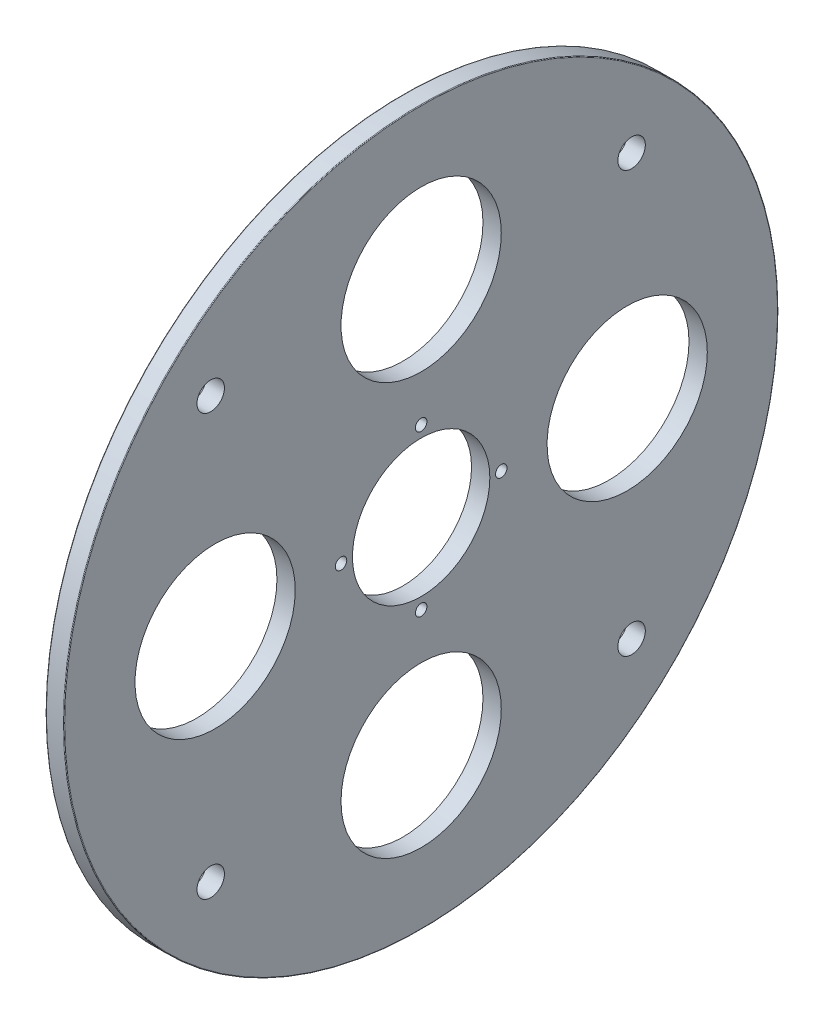
from build123d import *

# Parameters (mm, degrees)
SKETCH_1_R               = 156
EXTRUDE_1_DEPTH          = 8
SKETCH_2_R               = 30
CUT_EXTRUDE_1_DEPTH      = 10
SKETCH_3_R               = 35
CUT_EXTRUDE_2_DEPTH      = 10
PATTERN_CIRCULAR_1_COUNT = 4
SKETCH_4_R               = 6
CUT_EXTRUDE_3_DEPTH      = 10
PATTERN_CIRCULAR_2_COUNT = 4
SKETCH_6_R               = 2.5
CUT_EXTRUDE_5_DEPTH      = 10
PATTERN_CIRCULAR_4_COUNT = 4
FILLET_1_R               = 0.3


with BuildPart() as part:
    # 草图1 → 凸台-拉伸1 (new body)
    with BuildSketch(Plane(origin=(0, 0, 0), x_dir=(0, 0, -1), z_dir=(1, 0, 0))):
        Circle(SKETCH_1_R)
    extrude(amount=EXTRUDE_1_DEPTH)

    # 草图2 → 切除-拉伸1 (cut)
    with BuildSketch(Plane(origin=(8, 0, 0), x_dir=(0, 0, -1), z_dir=(1, 0, 0))):
        Circle(SKETCH_2_R)
    extrude(amount=-CUT_EXTRUDE_1_DEPTH, mode=Mode.SUBTRACT)

    # 草图3 → 切除-拉伸2 (cut)
    with BuildSketch(Plane(origin=(8, 0, 0), x_dir=(0, 0, -1), z_dir=(1, 0, 0))):
        with Locations((0, 90)):
            Circle(SKETCH_3_R)
    cut_extrude_2 = extrude(amount=-CUT_EXTRUDE_2_DEPTH, mode=Mode.SUBTRACT)

    # 阵列(圆周)1: 切除-拉伸2 ×4 about axis
    pattern_circular_1_axis = Axis((0, 0, 0), (1, 0, 0))
    for i in range(1, PATTERN_CIRCULAR_1_COUNT):
        add(cut_extrude_2.rotate(pattern_circular_1_axis, i * 360 / PATTERN_CIRCULAR_1_COUNT), mode=Mode.SUBTRACT)

    # 草图4 → 切除-拉伸3 (cut)
    with BuildSketch(Plane(origin=(8, 0, 0), x_dir=(0, 0, -1), z_dir=(1, 0, 0))):
        with Locations((91.923881554, 91.923881554)):
            Circle(SKETCH_4_R)
    cut_extrude_3 = extrude(amount=-CUT_EXTRUDE_3_DEPTH, mode=Mode.SUBTRACT)

    # 阵列(圆周)2: 切除-拉伸3 ×4 about axis
    pattern_circular_2_axis = Axis((0, 0, 0), (1, 0, 0))
    for i in range(1, PATTERN_CIRCULAR_2_COUNT):
        add(cut_extrude_3.rotate(pattern_circular_2_axis, i * 360 / PATTERN_CIRCULAR_2_COUNT), mode=Mode.SUBTRACT)

    # 草图6 → 切除-拉伸5 (cut)
    with BuildSketch(Plane(origin=(8, 0, 0), x_dir=(0, 0, -1), z_dir=(1, 0, 0))):
        with Locations((0, 35)):
            Circle(SKETCH_6_R)
    cut_extrude_5 = extrude(amount=-CUT_EXTRUDE_5_DEPTH, mode=Mode.SUBTRACT)

    # 阵列(圆周)4: 切除-拉伸5 ×4 about axis
    pattern_circular_4_axis = Axis((0, 0, 0), (1, 0, 0))
    for i in range(1, PATTERN_CIRCULAR_4_COUNT):
        add(cut_extrude_5.rotate(pattern_circular_4_axis, i * 360 / PATTERN_CIRCULAR_4_COUNT), mode=Mode.SUBTRACT)

    # 圆角1
    fillet_1_edges = [part.edges().sort_by_distance(p)[0] for p in [
        (0, 0, 156),
        (8, 0, 156),
    ]]
    fillet(fillet_1_edges, radius=FILLET_1_R)


solid = part.part
